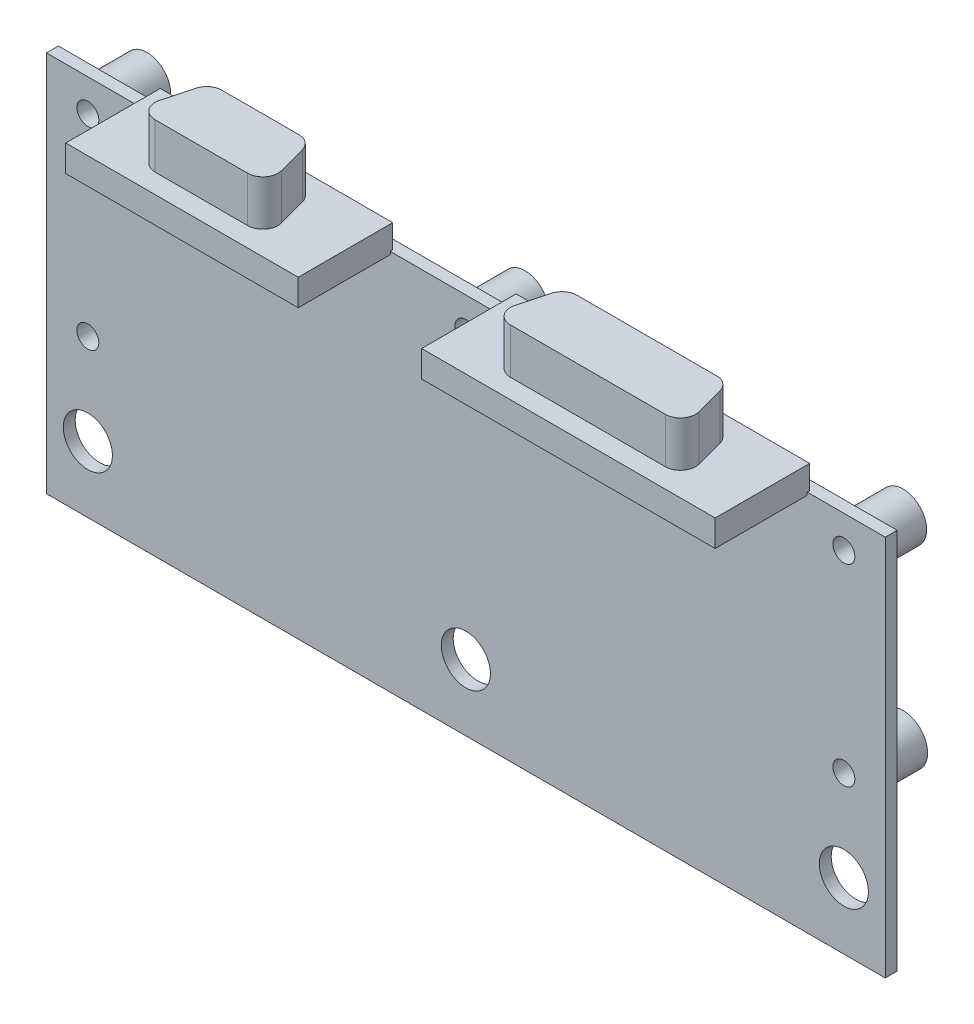
from build123d import *

# Parameters (mm, degrees)
SKETCH1_W          = 112.7252
SKETCH1_H          = 51.308
EXTRUDE1_DEPTH     = 1.6002
EXTRUDE2_REACH     = 78.632
SKETCH2_R          = 3.175
SKETCH2_R_2        = 3.302
SKETCH3_R          = 3.302
SKETCH3_R_2        = 1.4732
CUT_EXTRUDE1_DEPTH = 12.7
SKETCH4_W          = 31.242
SKETCH4_H          = 12.7
SKETCH4_W_2        = 39.4462
EXTRUDE3_DEPTH     = 3.556
EXTRUDE4_DEPTH     = 6.096


with BuildPart() as part:
    # Sketch1 → Extrude1 (new body)
    with BuildSketch(Plane.XY.offset(6.35)):
        with Locations((0, -25.654)):
            Rectangle(SKETCH1_W, SKETCH1_H)
    extrude(amount=EXTRUDE1_DEPTH)

    # Sketch2 → Extrude2 (add, up to next)
    with BuildSketch(Plane.XY, mode=Mode.PRIVATE) as extrude2_sk1:
        with Locations(Location((-50.8, -4.318, 0), (0, 0, 180))):
            Circle(SKETCH2_R)
    extrude2_tool1 = extrude(extrude2_sk1.sketch, amount=EXTRUDE2_REACH, mode=Mode.PRIVATE) - part.part
    # Sketch2 → Extrude2 (add, up to next)
    with BuildSketch(Plane.XY, mode=Mode.PRIVATE) as extrude2_sk2:
        with Locations(Location((50.8, -4.318, 0), (0, 0, 180))):
            Circle(SKETCH2_R)
    extrude2_tool2 = extrude(extrude2_sk2.sketch, amount=EXTRUDE2_REACH, mode=Mode.PRIVATE) - part.part
    # Sketch2 → Extrude2 (add, up to next)
    with BuildSketch(Plane.XY, mode=Mode.PRIVATE) as extrude2_sk3:
        with Locations(Location((-50.8, -30.226, 0), (0, 0, 180))):
            Circle(SKETCH2_R_2)
    extrude2_tool3 = extrude(extrude2_sk3.sketch, amount=EXTRUDE2_REACH, mode=Mode.PRIVATE) - part.part
    # Sketch2 → Extrude2 (add, up to next)
    with BuildSketch(Plane.XY, mode=Mode.PRIVATE) as extrude2_sk4:
        with Locations(Location((50.8, -30.226, 0), (0, 0, 180))):
            Circle(SKETCH2_R_2)
    extrude2_tool4 = extrude(extrude2_sk4.sketch, amount=EXTRUDE2_REACH, mode=Mode.PRIVATE) - part.part
    # Sketch2 → Extrude2 (add, up to next)
    with BuildSketch(Plane.XY, mode=Mode.PRIVATE) as extrude2_sk5:
        with Locations(Location((0, -4.318, 0), (0, 0, 180))):
            Circle(SKETCH2_R)
    extrude2_tool5 = extrude(extrude2_sk5.sketch, amount=EXTRUDE2_REACH, mode=Mode.PRIVATE) - part.part
    add(extrude2_tool1.solids().sort_by_distance((-50.8, -4.318, 0))[0])
    add(extrude2_tool2.solids().sort_by_distance((50.8, -4.318, 0))[0])
    add(extrude2_tool3.solids().sort_by_distance((-50.8, -30.226, 0))[0])
    add(extrude2_tool4.solids().sort_by_distance((50.8, -30.226, 0))[0])
    add(extrude2_tool5.solids().sort_by_distance((0, -4.318, 0))[0])

    # Sketch3 → Cut-Extrude1 (cut)
    with BuildSketch(Plane.XY):
        with Locations(Location((50.8, -42.418, 0), (0, 0, 180))):
            Circle(SKETCH3_R)
        with Locations(Location((0, -42.418, 0), (0, 0, 180))):
            Circle(SKETCH3_R)
        with Locations(Location((-50.8, -42.418, 0), (0, 0, 180))):
            Circle(SKETCH3_R)
        with Locations(Location((50.8, -30.226, 0), (0, 0, 180))):
            Circle(SKETCH3_R_2)
        with Locations(Location((50.8, -4.318, 0), (0, 0, 180))):
            Circle(SKETCH3_R_2)
        with Locations(Location((0, -4.318, 0), (0, 0, 180))):
            Circle(SKETCH3_R_2)
        with Locations(Location((-50.8, -4.318, 0), (0, 0, 180))):
            Circle(SKETCH3_R_2)
        with Locations(Location((-50.8, -30.226, 0), (0, 0, 180))):
            Circle(SKETCH3_R_2)
    extrude(amount=CUT_EXTRUDE1_DEPTH, mode=Mode.SUBTRACT)

    # Sketch4 → Extrude3 (add)
    with BuildSketch(Plane(origin=(0, 3.175, 0), x_dir=(-1, 0, 0), z_dir=(0, 1, 0))):
        with Locations((25.781, 13.97)):
            Rectangle(SKETCH4_W, SKETCH4_H)
        with Locations((-26.1493, 13.97)):
            Rectangle(SKETCH4_W_2, SKETCH4_H)
    extrude(amount=-EXTRUDE3_DEPTH)

    # Sketch5 → Extrude4 (add)
    with BuildSketch(Plane(origin=(0, 3.175, 0), x_dir=(1, 0, 0), z_dir=(0, 1, 0))):
        with BuildLine():
            Line((15.7353, -17.7038), (36.5633, -17.7038))
            ThreePointArc((36.5633, -17.7038), (38.175393987, -16.908803224), (38.526061279, -15.1458797))
            Line((38.526061279, -15.1458797), (37.491563037, -11.2850797))
            ThreePointArc((37.491563037, -11.2850797), (36.765804982, -10.198906013), (35.528801758, -9.779))
            Line((35.528801758, -9.779), (16.769798242, -9.779))
            ThreePointArc((16.769798242, -9.779), (15.532795018, -10.198906013), (14.807036963, -11.2850797))
            Line((14.807036963, -11.2850797), (13.772538721, -15.1458797))
            ThreePointArc((13.772538721, -15.1458797), (14.123206013, -16.908803224), (15.7353, -17.7038))
        make_face()
        with BuildLine():
            Line((-30.969501758, -9.779), (-20.592498242, -9.779))
            ThreePointArc((-20.592498242, -9.779), (-19.355495018, -10.198906013), (-18.629736963, -11.2850797))
            Line((-18.629736963, -11.2850797), (-17.595238721, -15.1458797))
            ThreePointArc((-17.595238721, -15.1458797), (-17.945906013, -16.908803224), (-19.558, -17.7038))
            Line((-19.558, -17.7038), (-32.004, -17.7038))
            ThreePointArc((-32.004, -17.7038), (-33.616093987, -16.908803224), (-33.966761279, -15.1458797))
            Line((-33.966761279, -15.1458797), (-32.932263037, -11.2850797))
            ThreePointArc((-32.932263037, -11.2850797), (-32.206504982, -10.198906013), (-30.969501758, -9.779))
        make_face()
    extrude(amount=EXTRUDE4_DEPTH)


solid = part.part
